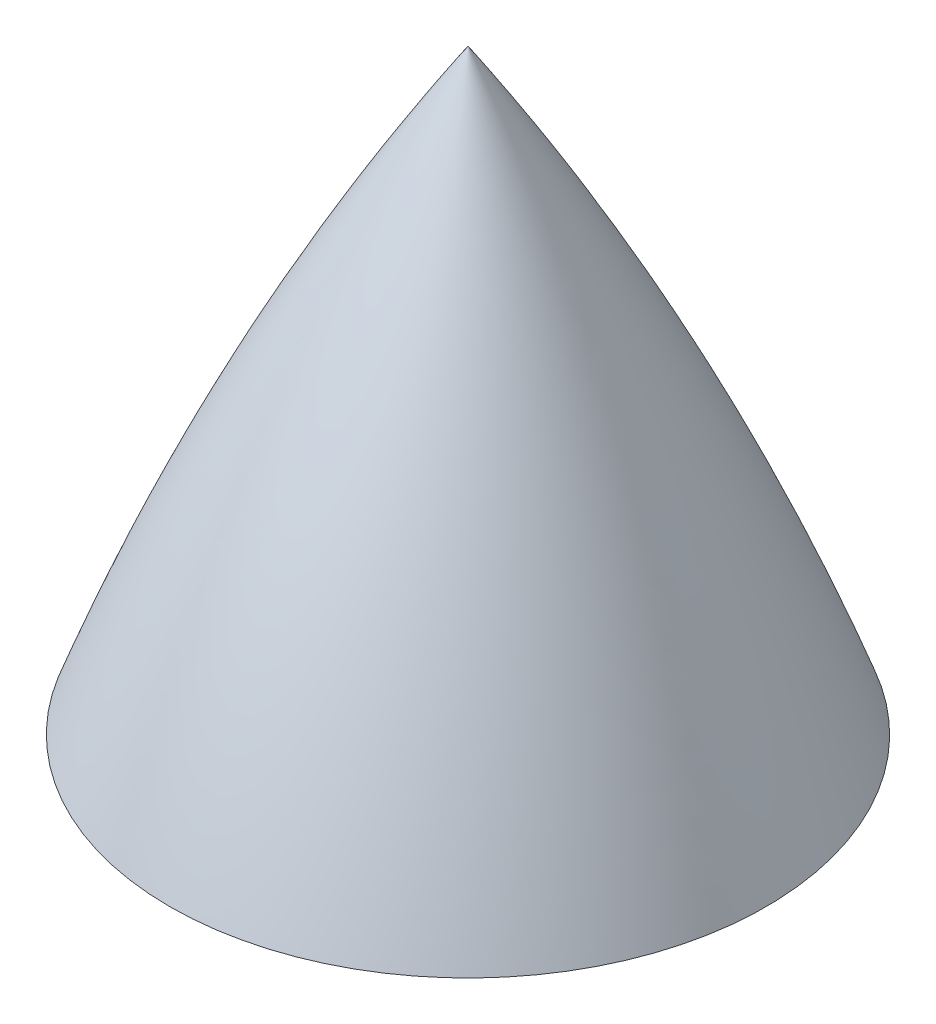
from build123d import *


with BuildPart() as part:
    # 草图1 → 旋转1 (revolve)
    with BuildSketch(Plane(origin=(0, 0, 0), x_dir=(0, 0, -1), z_dir=(1, 0, 0))):
        with BuildLine():
            Line((-0.2, 0.4), (-0.2, 0))
            Line((-0.2, 0), (0, 0))
            add(Edge.make_bspline(
                [(-0.2, 0.4), (-0.075907971, 0.210448915), (0, 0)],
                knots=[0, 0, 0, 1, 1, 1], degree=2))
        make_face()
    revolve(axis=Axis((0, 0.4, 0.2), (0, -1, 0)))


solid = part.part
